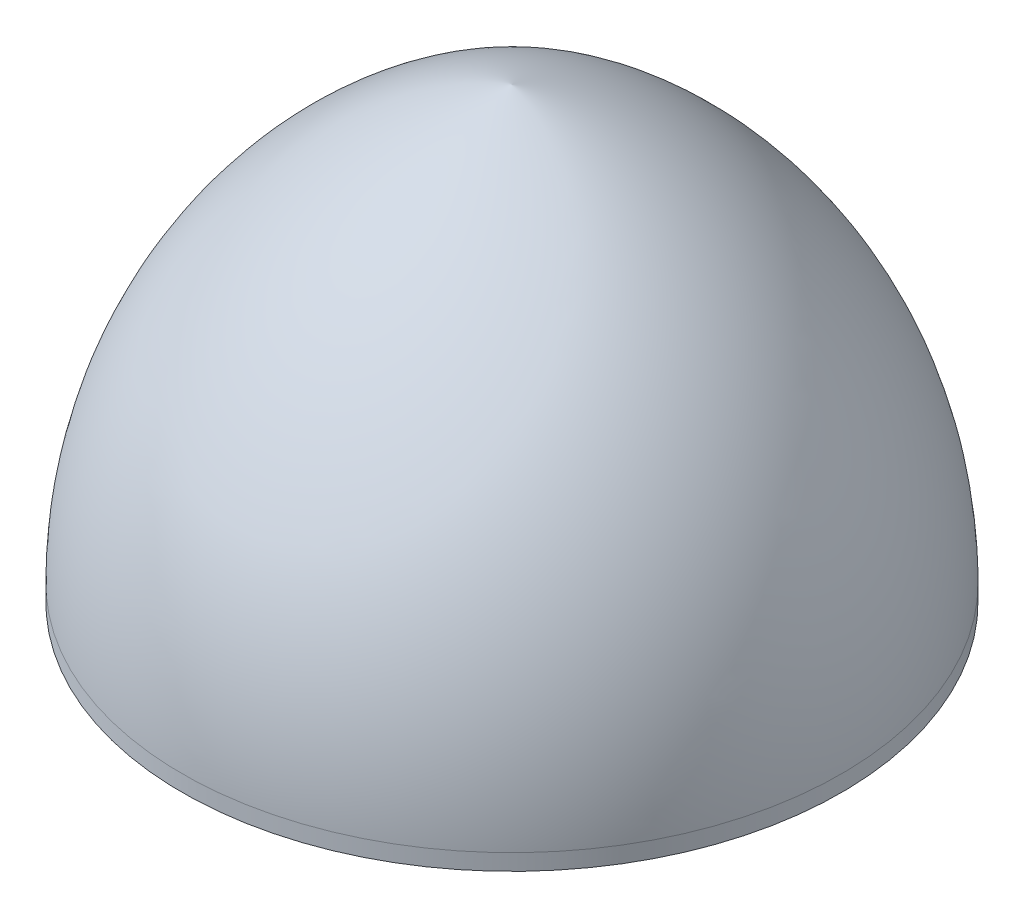
from build123d import *

# Parameters (mm, degrees)
SKETCH2_W      = 6
SKETCH2_H      = 3
REVOLVE8_ANGLE = 3
SKETCH3_W      = 3
SKETCH3_H      = 3
REVOLVE9_ANGLE = 15


with BuildPart() as part:
    # Sketch1 → Revolve7 (revolve)
    with BuildSketch(Plane.XY, mode=Mode.PRIVATE) as revolve7_sk:
        with BuildLine():
            Line((58, 170), (58, 167))
            Line((58, 167), (61, 167))
            Line((61, 167), (61, 170))
            ThreePointArc((61, 170), (44.010282534, 220.301590432), (0, 250))
            Line((0, 250), (0, 246.884627213))
            ThreePointArc((0, 246.884627213), (41.873834296, 218.154039035), (58, 170))
        make_face()
    revolve(revolve7_sk.sketch.rotate(Axis((0, 0, 0), (0, 1, 0)), 90), axis=Axis((0, 0, 0), (0, 1, 0)))

    # Sketch2 → Revolve8 (revolve)
    with BuildSketch(Plane.XY):
        with Locations((55, 168.5)):
            Rectangle(SKETCH2_W, SKETCH2_H)
        with Locations((-55, 168.5)):
            Rectangle(SKETCH2_W, SKETCH2_H)
    revolve(axis=Axis((0, 250, 0), (0, 1, 0)), revolution_arc=REVOLVE8_ANGLE)

    # Sketch3 → Revolve9 (revolve)
    with BuildSketch(Plane.XY):
        with Locations((50.5, 168.5)):
            Rectangle(SKETCH3_W, SKETCH3_H)
        with Locations((-50.5, 168.5)):
            Rectangle(SKETCH3_W, SKETCH3_H)
    revolve(axis=Axis((0, 250, 0), (0, 1, 0)), revolution_arc=REVOLVE9_ANGLE)


solid = part.part
